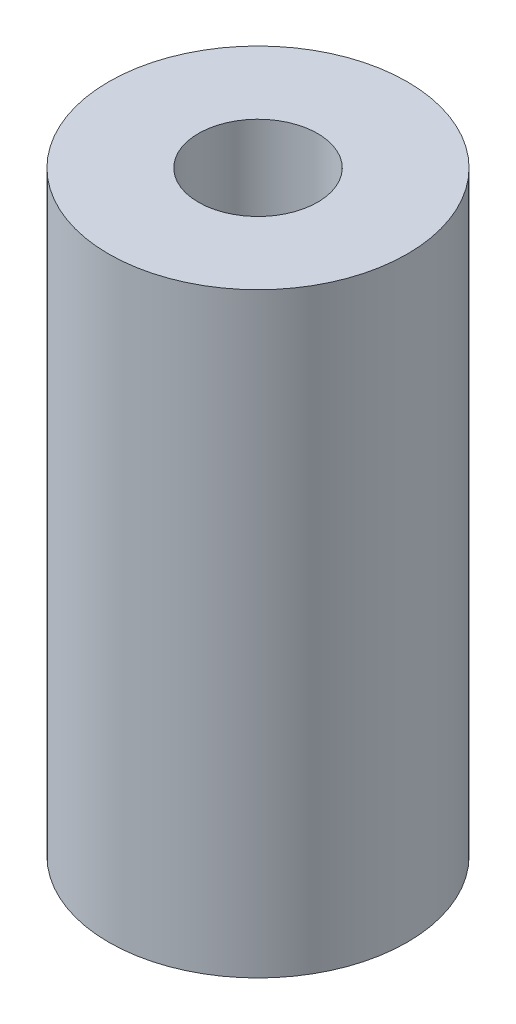
from build123d import *

# Parameters (mm, degrees)
SKETCH1_R           = 15.9004
BOSS_EXTRUDE1_DEPTH = 63.5
SKETCH2_R           = 6.35
CUT_EXTRUDE1_DEPTH  = 68.363903096


with BuildPart() as part:
    # Sketch1 → Boss-Extrude1 (new body)
    with BuildSketch(Plane(origin=(0, 0, 0), x_dir=(1, 0, 0), z_dir=(0, 1, 0))):
        with Locations(Location((0, 0, 0), (0, 0, 270))):
            Circle(SKETCH1_R)
    extrude(amount=BOSS_EXTRUDE1_DEPTH)

    # Sketch2 → Cut-Extrude1 (cut, through all)
    with BuildSketch(Plane(origin=(0, 63.5, 0), x_dir=(1, 0, 0), z_dir=(0, 1, 0))):
        with Locations(Location((0, 0, 0), (0, 0, 270))):
            Circle(SKETCH2_R)
    extrude(amount=-CUT_EXTRUDE1_DEPTH, mode=Mode.SUBTRACT)


solid = part.part
